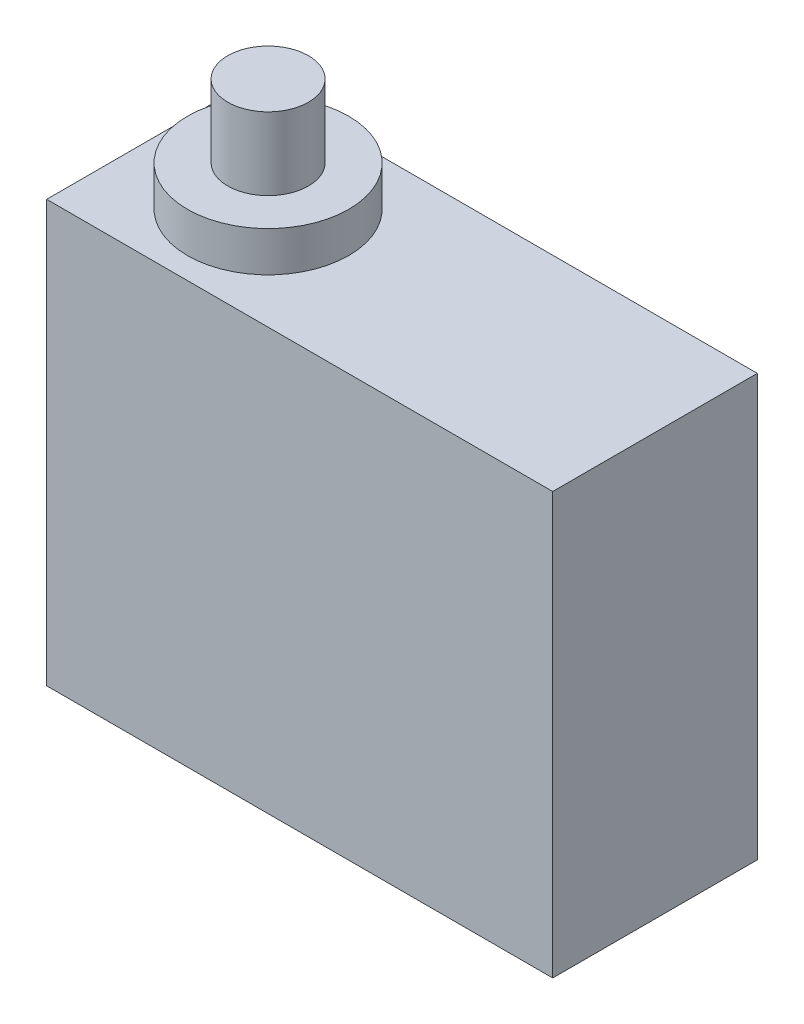
from build123d import *

# Parameters (mm, degrees)
SKETCH2_W           = 18.82
SKETCH2_H           = 15.67
BOSS_EXTRUDE1_DEPTH = 3.805
SKETCH3_R           = 3
BOSS_EXTRUDE2_DEPTH = 1.49
SKETCH4_R           = 1.5
BOSS_EXTRUDE3_DEPTH = 2.7


with BuildPart() as part:
    # Sketch2 → Boss-Extrude1 (new, symmetric)
    with BuildSketch(Plane.XY):
        Rectangle(SKETCH2_W, SKETCH2_H)
    extrude(amount=BOSS_EXTRUDE1_DEPTH, both=True)

    # Sketch3 → Boss-Extrude2 (add)
    with BuildSketch(Plane(origin=(0, 7.835, 0), x_dir=(1, 0, 0), z_dir=(0, 1, 0))):
        with Locations((-4.98, 0)):
            Circle(SKETCH3_R)
    extrude(amount=BOSS_EXTRUDE2_DEPTH)

    # Sketch4 → Boss-Extrude3 (add)
    with BuildSketch(Plane(origin=(0, 9.325, 0), x_dir=(1, 0, 0), z_dir=(0, 1, 0))):
        with Locations((-4.98, 0)):
            Circle(SKETCH4_R)
    extrude(amount=BOSS_EXTRUDE3_DEPTH)


solid = part.part
